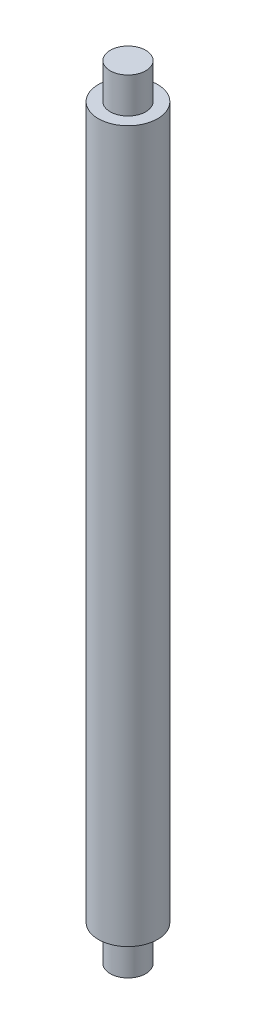
from build123d import *

# Parameters (mm, degrees)
SKETCH_1_R      = 2.5
EXTRUDE_2_DEPTH = 30
SKETCH_2_R      = 1.5
EXTRUDE_3_DEPTH = 3
EXTRUDE_START   = 3
SKETCH_3_R      = 1.5
EXTRUDE_4_DEPTH = 3


with BuildPart() as part:
    # 草图1 → 凸台-拉伸2 (new, symmetric)
    with BuildSketch(Plane(origin=(0, 0, 0), x_dir=(1, 0, 0), z_dir=(0, 1, 0))):
        with Locations(Location((0, 0, 0), (0, 0, 270))):
            Circle(SKETCH_1_R)
    extrude(amount=EXTRUDE_2_DEPTH, both=True)

    # 草图2 → 凸台-拉伸3 (add)
    with BuildSketch(Plane(origin=(0, 30, 0), x_dir=(1, 0, 0), z_dir=(0, 1, 0))):
        with Locations(Location((0, 0, 0), (0, 0, 270))):
            Circle(SKETCH_2_R)
    extrude(amount=EXTRUDE_3_DEPTH)

    # 草图3 → 凸台-拉伸4 (add)
    with BuildSketch(Plane.XZ.offset(30).offset(EXTRUDE_START)):
        with Locations(Location((0, 0, 0), (0, 0, 90))):
            Circle(SKETCH_3_R)
    extrude(amount=-EXTRUDE_4_DEPTH)


solid = part.part
